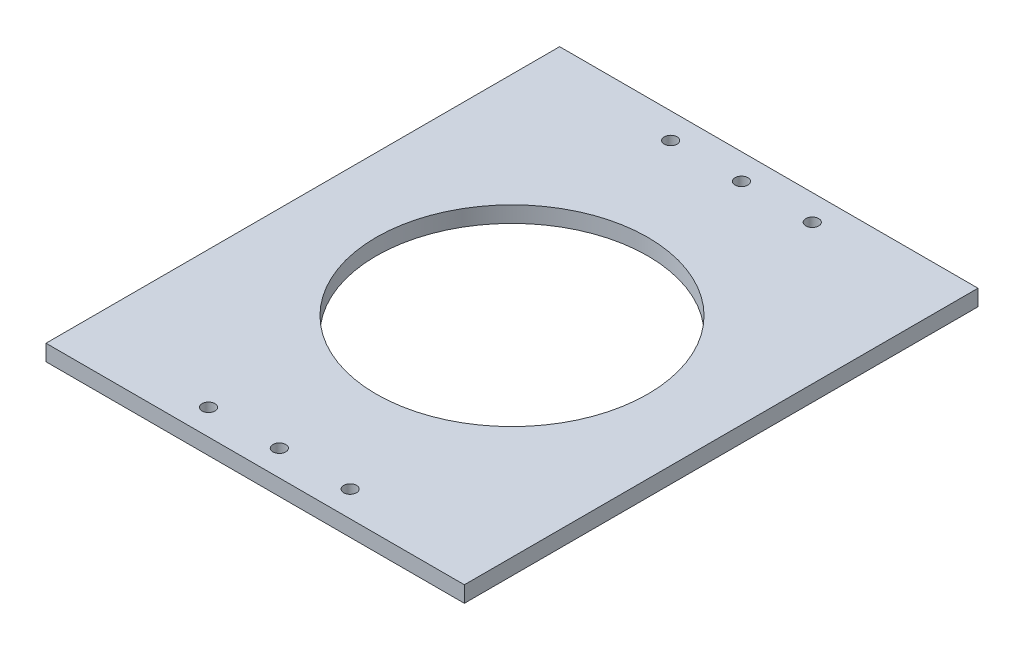
from build123d import *

# Parameters (mm, degrees)
SKETCH1_W           = 130
SKETCH1_H           = 159.6
SKETCH1_R           = 42.197881281
SKETCH1_R_2         = 2
BOSS_EXTRUDE1_DEPTH = 5


with BuildPart() as part:
    # Sketch1 → Boss-Extrude1 (new body)
    with BuildSketch(Plane(origin=(0, 0, 0), x_dir=(1, 0, 0), z_dir=(0, 1, 0))):
        with Locations((-276.66296023, 35.624722657)):
            Rectangle(SKETCH1_W, SKETCH1_H)
        with Locations(Location((-276.66296023, 35.624722657, 0), (0, 0, 270))):
            Circle(SKETCH1_R, mode=Mode.SUBTRACT)
        with Locations(Location((-299.16296023, 107.424722657, 0), (0, 0, 270))):
            Circle(SKETCH1_R_2, mode=Mode.SUBTRACT)
        with Locations(Location((-277.16296023, 107.424722657, 0), (0, 0, 270))):
            Circle(SKETCH1_R_2, mode=Mode.SUBTRACT)
        with Locations(Location((-255.16296023, 107.424722657, 0), (0, 0, 270))):
            Circle(SKETCH1_R_2, mode=Mode.SUBTRACT)
        with Locations(Location((-255.16296023, -36.175277343, 0), (0, 0, 90))):
            Circle(SKETCH1_R_2, mode=Mode.SUBTRACT)
        with Locations(Location((-277.16296023, -36.175277343, 0), (0, 0, 90))):
            Circle(SKETCH1_R_2, mode=Mode.SUBTRACT)
        with Locations(Location((-299.16296023, -36.175277343, 0), (0, 0, 90))):
            Circle(SKETCH1_R_2, mode=Mode.SUBTRACT)
    extrude(amount=BOSS_EXTRUDE1_DEPTH)


solid = part.part
